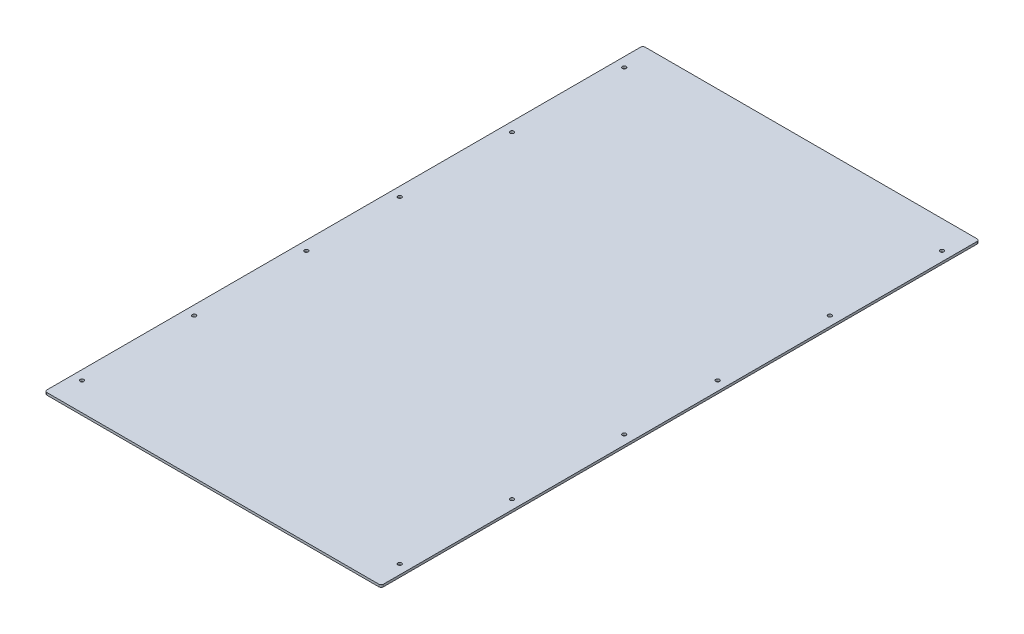
from build123d import *

# Parameters (mm, degrees)
SKETCH1_W                  = 457.2
SKETCH1_H                  = 812.8
BOSS_EXTRUDE1_DEPTH        = 3.175
F_7_0_201_DIAMETER_HOLE1_D = 5.1054
FILLET1_R                  = 3.175


with BuildPart() as part:
    # Sketch1 → Boss-Extrude1 (new body)
    with BuildSketch(Plane(origin=(0, 0, 0), x_dir=(1, 0, 0), z_dir=(0, 1, 0))):
        Rectangle(SKETCH1_W, SKETCH1_H)
    extrude(amount=BOSS_EXTRUDE1_DEPTH)

    # #7 (0.201) Diameter Hole1 (through all)
    with Locations(Plane(origin=(0, 3.175, 0), x_dir=(1, 0, 0), z_dir=(0, 1, 0))):
        with Locations((-215.9, 368.3), (215.9, 368.3), (215.9, 215.9), (215.9, 63.5), (215.9, -63.5), (215.9, -215.9), (215.9, -368.3), (-215.9, 215.9), (-215.9, 63.5), (-215.9, -63.5), (-215.9, -215.9), (-215.9, -368.3)):
            Hole(F_7_0_201_DIAMETER_HOLE1_D / 2)

    # Fillet1
    fillet1_edges = [part.edges().sort_by_distance(p)[0] for p in [
        (228.6, 1.5875, 406.4),
        (-228.6, 1.5875, 406.4),
        (-228.6, 1.5875, -406.4),
        (228.6, 1.5875, -406.4),
    ]]
    fillet(fillet1_edges, radius=FILLET1_R)


solid = part.part
